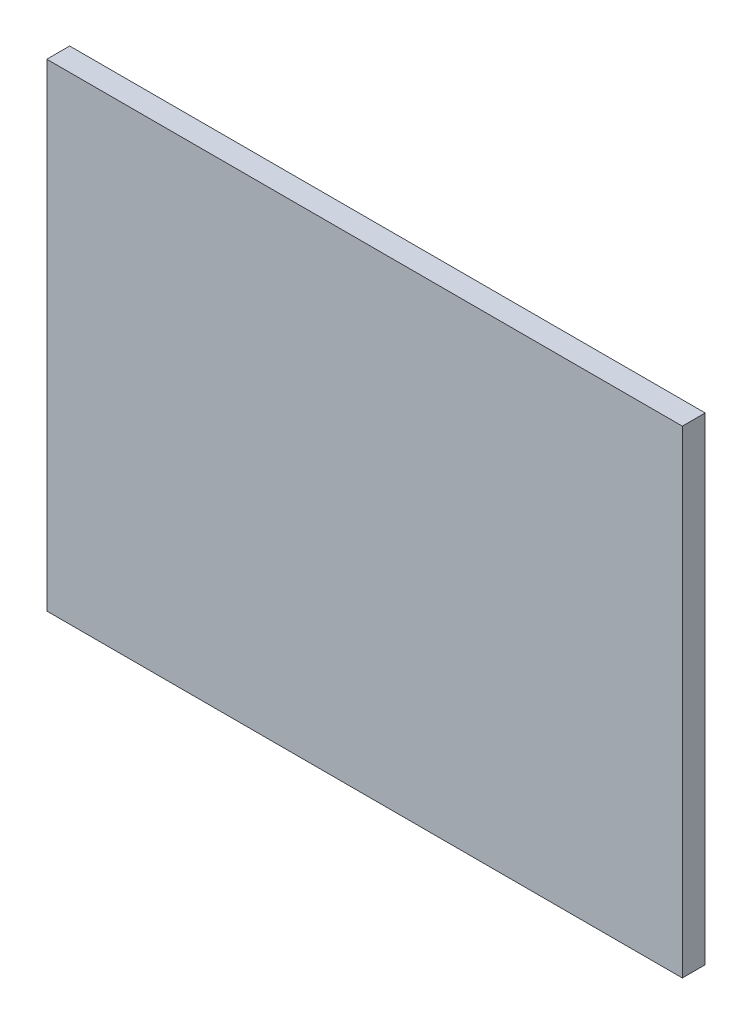
from build123d import *

# Parameters (mm, degrees)
SKETCH1_W           = 500
SKETCH1_H           = 376
BOSS_EXTRUDE1_DEPTH = 18


with BuildPart() as part:
    # Sketch1 → Boss-Extrude1 (new body)
    with BuildSketch(Plane.XY):
        with Locations((250, 188)):
            Rectangle(SKETCH1_W, SKETCH1_H)
    extrude(amount=BOSS_EXTRUDE1_DEPTH)


solid = part.part
